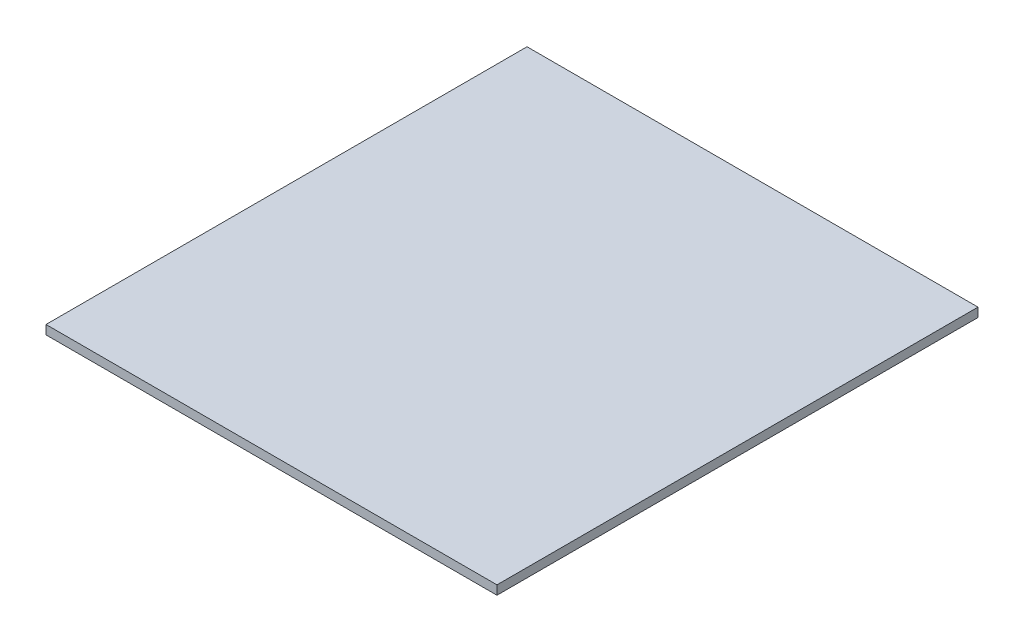
from build123d import *

# Parameters (mm, degrees)
SKETCH1_W           = 150
SKETCH1_H           = 160
BOSS_EXTRUDE1_DEPTH = 3


with BuildPart() as part:
    # Sketch1 → Boss-Extrude1 (new body)
    with BuildSketch(Plane(origin=(0, 0, 0), x_dir=(1, 0, 0), z_dir=(0, 1, 0))):
        Rectangle(SKETCH1_W, SKETCH1_H)
    extrude(amount=BOSS_EXTRUDE1_DEPTH)


solid = part.part
